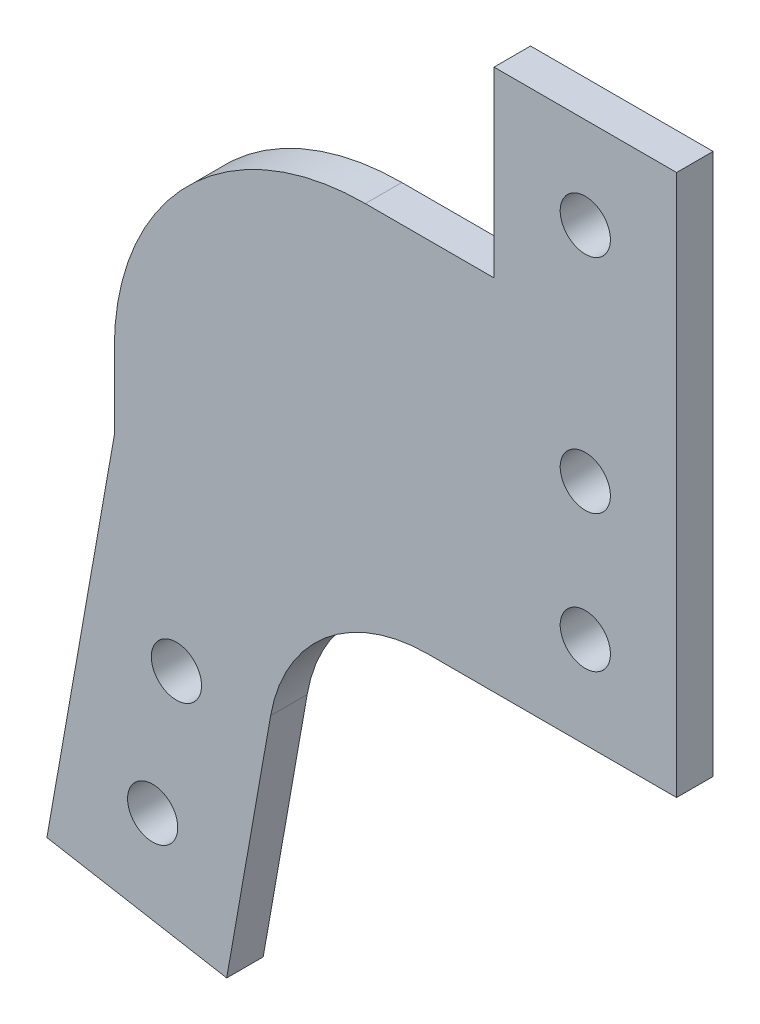
from build123d import *

# Parameters (mm, degrees)
SKETCH1_R           = 2.75
BOSS_EXTRUDE1_DEPTH = 4


with BuildPart() as part:
    # Sketch1 → Boss-Extrude1 (new body)
    with BuildSketch(Plane.XY):
        with BuildLine():
            Line((14.684243546, 0), (41.920581655, 0))
            Line((41.920581655, 0), (41.920581655, 59.3))
            Line((41.920581655, 59.3), (21.920581655, 59.3))
            Line((21.920581655, 59.3), (21.920581655, 39.3))
            Line((21.920581655, 39.3), (7.820581655, 39.3))
            ThreePointArc((7.820581655, 39.3), (-11.624854827, 31.245436483), (-19.679418345, 11.8))
            Line((-19.679418345, 11.8), (-19.679418345, 3.567882185))
            Line((-19.679418345, 3.567882185), (-27.059465895, -38.286447318))
            Line((-27.059465895, -38.286447318), (-7.363310835, -41.759410871))
            Line((-7.363310835, -41.759410871), (-2.549892132, -14.461156891))
            ThreePointArc((-2.549892132, -14.461156891), (3.435460376, -4.094222245), (14.684243546, 0))
        make_face()
        with Locations((31.920581655, 49.3)):
            Circle(SKETCH1_R, mode=Mode.SUBTRACT)
        with Locations((31.920581655, 25)):
            Circle(SKETCH1_R, mode=Mode.SUBTRACT)
        with Locations((31.920581655, 10)):
            Circle(SKETCH1_R, mode=Mode.SUBTRACT)
        with Locations((-15.474906589, -30.174851565)):
            Circle(SKETCH1_R, mode=Mode.SUBTRACT)
        with Locations((-12.870183924, -15.402735269)):
            Circle(SKETCH1_R, mode=Mode.SUBTRACT)
    extrude(amount=BOSS_EXTRUDE1_DEPTH)


solid = part.part
